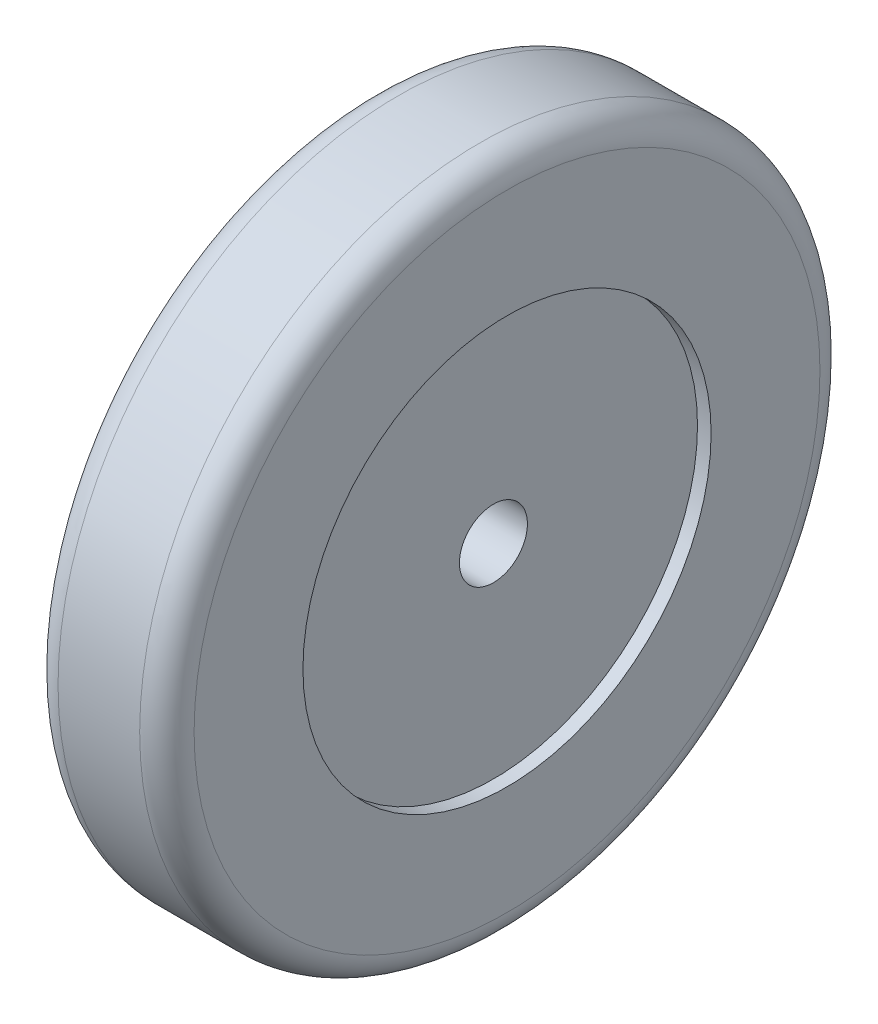
from build123d import *

# Parameters (mm, degrees)
SKETCH1_R           = 31.75
BOSS_EXTRUDE1_DEPTH = 6.35
SKETCH2_R           = 3.175
CUT_EXTRUDE1_DEPTH  = 47.6627796
FILLET1_R           = 2.54
SKETCH3_R           = 19.05
CUT_EXTRUDE2_DEPTH  = 1.27


with BuildPart() as part:
    # Sketch1 → Boss-Extrude1 (new, symmetric)
    with BuildSketch(Plane(origin=(0, 0, 0), x_dir=(0, 0, -1), z_dir=(1, 0, 0))):
        Circle(SKETCH1_R)
    extrude(amount=BOSS_EXTRUDE1_DEPTH, both=True)

    # Sketch2 → Cut-Extrude1 (cut, through all)
    with BuildSketch(Plane(origin=(6.35, 0, 0), x_dir=(0, 0, -1), z_dir=(1, 0, 0))):
        Circle(SKETCH2_R)
    extrude(amount=-CUT_EXTRUDE1_DEPTH, mode=Mode.SUBTRACT)

    # Fillet1
    fillet1_edges = [part.edges().sort_by_distance(p)[0] for p in [
        (-6.35, 0, 31.75),
        (6.35, 0, 31.75),
    ]]
    fillet(fillet1_edges, radius=FILLET1_R)

    # Sketch3 → Cut-Extrude2 (cut)
    with BuildSketch(Plane(origin=(6.35, 0, 0), x_dir=(0, 0, -1), z_dir=(1, 0, 0))):
        Circle(SKETCH3_R)
    cut_extrude2 = extrude(amount=-CUT_EXTRUDE2_DEPTH, mode=Mode.SUBTRACT)

    # Mirror1: Cut-Extrude2 across plane
    add(cut_extrude2.mirror(Plane(origin=(0, 0, 0), x_dir=(0, 0, 1), z_dir=(1, 0, 0))), mode=Mode.SUBTRACT)


solid = part.part
